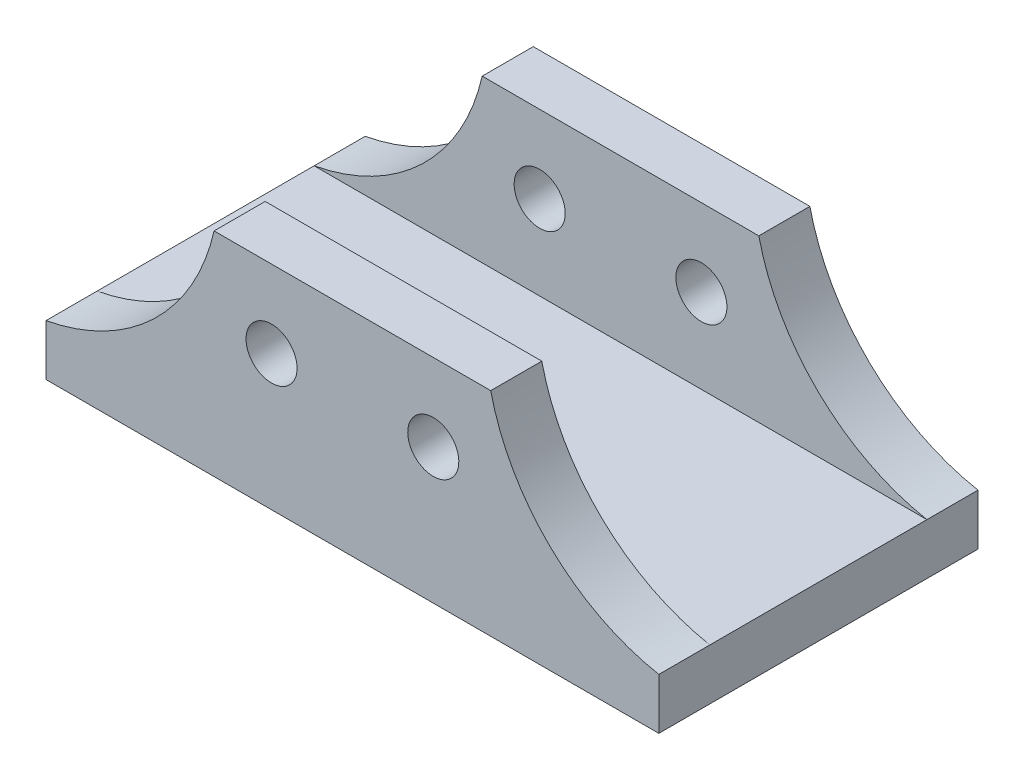
from build123d import *

# Parameters (mm, degrees)
SKETCH1_W           = 144
SKETCH1_H           = 75
BOSS_EXTRUDE1_DEPTH = 12
SKETCH2_R           = 6
BOSS_EXTRUDE2_DEPTH = 75
SKETCH3_W           = 51
SKETCH3_H           = 38
CUT_EXTRUDE1_DEPTH  = 96


with BuildPart() as part:
    # Sketch1 → Boss-Extrude1 (new body)
    with BuildSketch(Plane(origin=(0, 0, 0), x_dir=(1, 0, 0), z_dir=(0, 1, 0))):
        Rectangle(SKETCH1_W, SKETCH1_H)
    extrude(amount=BOSS_EXTRUDE1_DEPTH)

    # Sketch2 → Boss-Extrude2 (add)
    with BuildSketch(Plane.XY.offset(37.5)):
        with BuildLine():
            Line((-32.5, 50), (32.5, 50))
            ThreePointArc((32.5, 50), (46.579087682, 25.10523588), (72, 12))
            Line((72, 12), (-72, 12))
            ThreePointArc((-72, 12), (-46.579087682, 25.10523588), (-32.5, 50))
        make_face()
        with Locations((-19, 31.786239806)):
            Circle(SKETCH2_R, mode=Mode.SUBTRACT)
        with Locations((19, 31.786239806)):
            Circle(SKETCH2_R, mode=Mode.SUBTRACT)
    extrude(amount=-BOSS_EXTRUDE2_DEPTH)

    # Sketch3 → Cut-Extrude1 (cut, symmetric)
    with BuildSketch(Plane(origin=(0, 0, 0), x_dir=(0, 0, -1), z_dir=(1, 0, 0))):
        with Locations((0, 31)):
            Rectangle(SKETCH3_W, SKETCH3_H)
    extrude(amount=CUT_EXTRUDE1_DEPTH, both=True, mode=Mode.SUBTRACT)


solid = part.part
